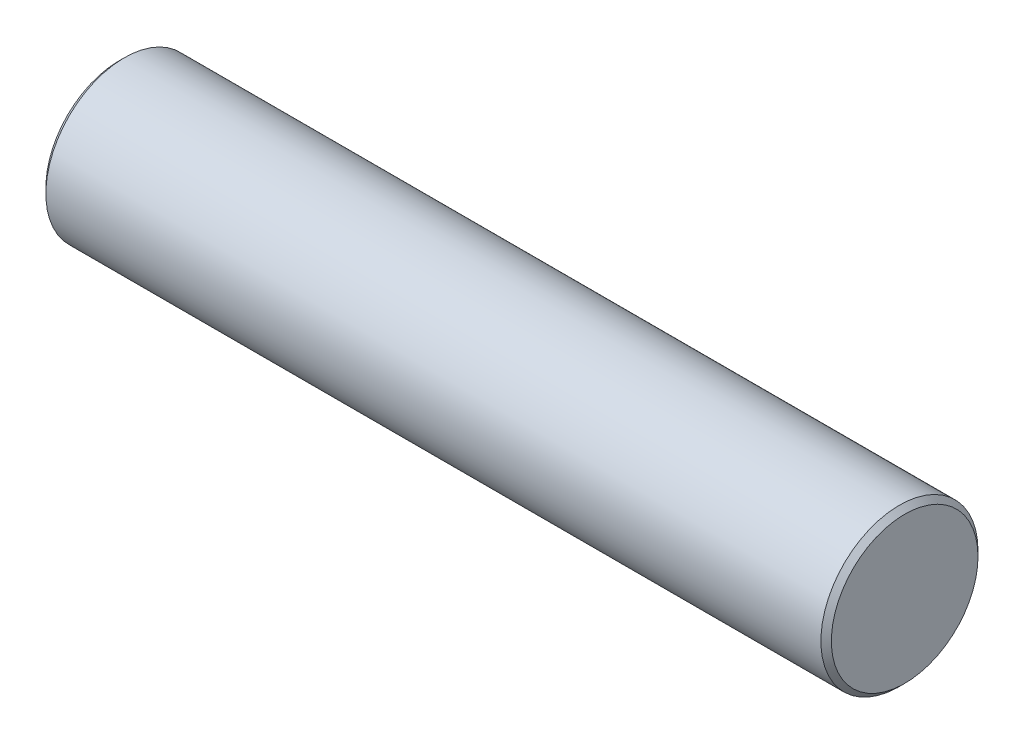
from build123d import *

# Parameters (mm, degrees)
SKETCH1_R           = 1.5
BOSS_EXTRUDE1_DEPTH = 7.5
CHAMFER1_SIZE       = 0.1


with BuildPart() as part:
    # Sketch1 → Boss-Extrude1 (new, symmetric)
    with BuildSketch(Plane(origin=(0, 0, 0), x_dir=(0, 0, -1), z_dir=(1, 0, 0))):
        Circle(SKETCH1_R)
    extrude(amount=BOSS_EXTRUDE1_DEPTH, both=True)

    # Chamfer1
    chamfer1_edges = [part.edges().sort_by_distance(p)[0] for p in [
        (-7.5, 0, 1.5),
        (7.5, 0, 1.5),
    ]]
    chamfer(chamfer1_edges, length=CHAMFER1_SIZE)


solid = part.part
